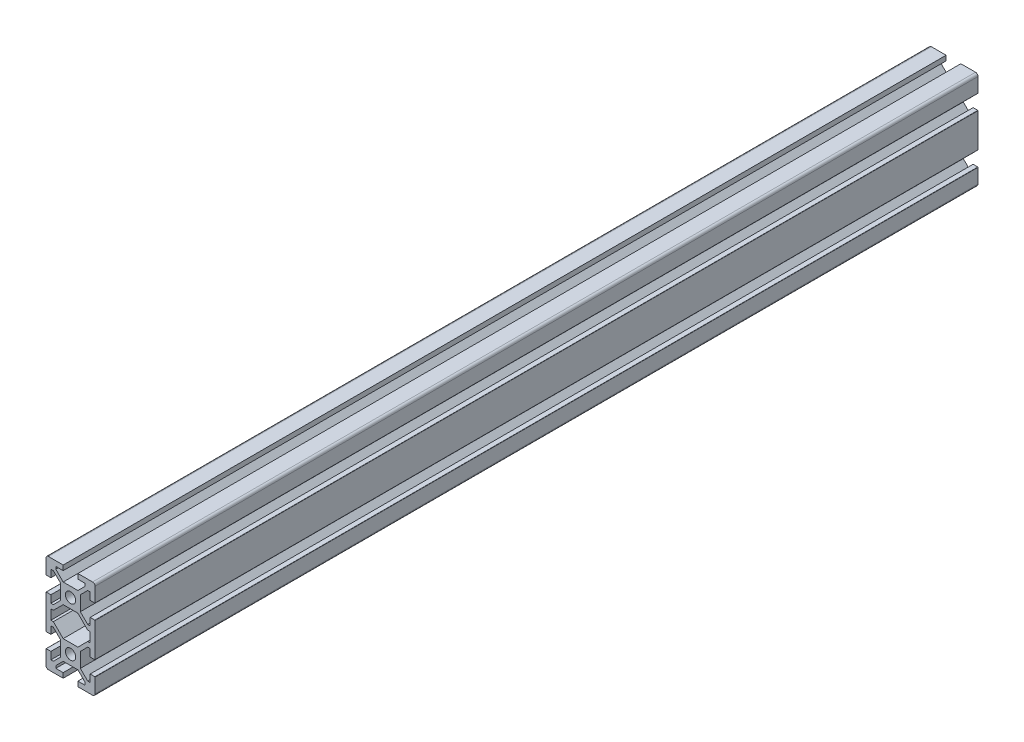
from build123d import *

# Parameters (mm, degrees)
SKETCH1_R           = 2.1
BOSS_EXTRUDE1_DEPTH = 360
FILLET1_R           = 0.1


with BuildPart() as part:
    # Sketch1 → Boss-Extrude1 (new body)
    with BuildSketch(Plane.XY):
        with BuildLine():
            Line((10, -19), (10, -13))
            Line((10, -13), (8, -13))
            Line((8, -13), (8, -16))
            Line((8, -16), (7, -16))
            Line((7, -16), (4, -13))
            Line((4, -13), (4, -7))
            Line((4, -7), (7, -4))
            Line((7, -4), (8, -4))
            Line((8, -4), (8, -7))
            Line((8, -7), (10, -7))
            Line((10, -7), (10, 7))
            Line((10, 7), (8, 7))
            Line((8, 7), (8, 4))
            Line((8, 4), (7, 4))
            Line((7, 4), (4, 7))
            Line((4, 7), (4, 13))
            Line((4, 13), (7, 16))
            Line((7, 16), (8, 16))
            Line((8, 16), (8, 13))
            Line((8, 13), (10, 13))
            Line((10, 13), (10, 19))
            ThreePointArc((10, 19), (9.707106781, 19.707106781), (9, 20))
            Line((9, 20), (3, 20))
            Line((3, 20), (3, 18))
            Line((3, 18), (6, 18))
            Line((6, 18), (6, 17))
            Line((6, 17), (3, 14))
            Line((3, 14), (-3, 14))
            Line((-3, 14), (-6, 17))
            Line((-6, 17), (-6, 18))
            Line((-6, 18), (-3, 18))
            Line((-3, 18), (-3, 20))
            Line((-3, 20), (-9, 20))
            ThreePointArc((-9, 20), (-9.707106781, 19.707106781), (-10, 19))
            Line((-10, 19), (-10, 13))
            Line((-10, 13), (-8, 13))
            Line((-8, 13), (-8, 16))
            Line((-8, 16), (-7, 16))
            Line((-7, 16), (-4, 13))
            Line((-4, 13), (-4, 7))
            Line((-4, 7), (-7, 4))
            Line((-7, 4), (-8, 4))
            Line((-8, 4), (-8, 7))
            Line((-8, 7), (-10, 7))
            Line((-10, 7), (-10, -7))
            Line((-10, -7), (-8, -7))
            Line((-8, -7), (-8, -4))
            Line((-8, -4), (-7, -4))
            Line((-7, -4), (-4, -7))
            Line((-4, -7), (-4, -13))
            Line((-4, -13), (-7, -16))
            Line((-7, -16), (-8, -16))
            Line((-8, -16), (-8, -13))
            Line((-8, -13), (-10, -13))
            Line((-10, -13), (-10, -19))
            ThreePointArc((-10, -19), (-9.707106781, -19.707106781), (-9, -20))
            Line((-9, -20), (-3, -20))
            Line((-3, -20), (-3, -18))
            Line((-3, -18), (-6, -18))
            Line((-6, -18), (-6, -17))
            Line((-6, -17), (-3, -14))
            Line((-3, -14), (3, -14))
            Line((3, -14), (6, -17))
            Line((6, -17), (6, -18))
            Line((6, -18), (3, -18))
            Line((3, -18), (3, -20))
            Line((3, -20), (9, -20))
            ThreePointArc((9, -20), (9.707106781, -19.707106781), (10, -19))
        make_face()
        with Locations((0, -10)):
            Circle(SKETCH1_R, mode=Mode.SUBTRACT)
        with Locations((0, 10)):
            Circle(SKETCH1_R, mode=Mode.SUBTRACT)
        Polygon((-7, -2), (-8, -2), (-8, 2), (-7, 2), (-3, 6), (3, 6), (7, 2), (8, 2), (8, -2), (7, -2), (3, -6), (-3, -6), align=None, mode=Mode.SUBTRACT)
    extrude(amount=-BOSS_EXTRUDE1_DEPTH)

    # Fillet1
    fillet1_edges = [part.edges().sort_by_distance(p)[0] for p in [
        (-10, -13, -180),
        (-10, -7, -180),
        (-10, 7, -180),
        (-10, 13, -180),
        (10, 13, -180),
        (10, 7, -180),
        (10, -7, -180),
        (10, -13, -180),
    ]]
    fillet(fillet1_edges, radius=FILLET1_R)


solid = part.part
